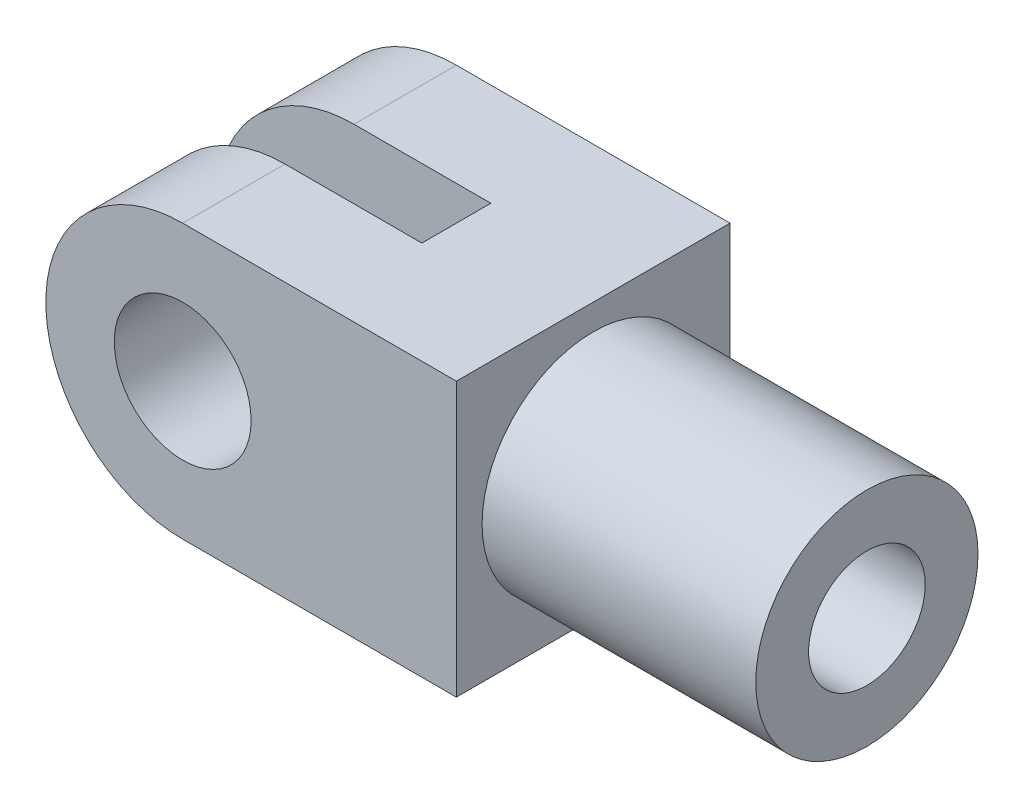
from build123d import *

# Parameters (mm, degrees)
BOSS_EXTRUDE1_DEPTH           = 6.35
SKETCH2_R                     = 2.5781
BOSS_EXTRUDE2_DEPTH           = 6.35
TAP_DRILL_FOR_6_32_TAP1_D     = 2.7051
TAP_DRILL_FOR_6_32_TAP1_DEPTH = 9.525
TAP_DRILL_FOR_6_32_TAP1_TIP   = 0.81269403
CUT_EXTRUDE1_REACH            = 15.091
SKETCH5_W                     = 10.16
SKETCH5_H                     = 1.6002
CUT_EXTRUDE2_REACH            = 15.091
SKETCH6_R                     = 1.5875
F_4_40_TAPPED_HOLE1_D         = 2.2606


with BuildPart() as part:
    # Sketch1 → Boss-Extrude1 (new body)
    with BuildSketch(Plane.XY):
        with BuildLine():
            Line((0, 0), (-6.35, 0))
            ThreePointArc((-6.35, 0), (-9.525, 3.175), (-6.35, 6.35))
            Line((-6.35, 6.35), (0, 6.35))
            Line((0, 6.35), (0, 0))
        make_face()
    extrude(amount=BOSS_EXTRUDE1_DEPTH)

    # Sketch2 → Boss-Extrude2 (add)
    with BuildSketch(Plane(origin=(0, 0, 0), x_dir=(0, 0, -1), z_dir=(1, 0, 0))):
        with Locations((-3.175, 3.175)):
            Circle(SKETCH2_R)
    extrude(amount=BOSS_EXTRUDE2_DEPTH)

    # Tap Drill for #6-32 Tap1
    with Locations(Plane(origin=(6.35, 0, 0), x_dir=(0, 0, -1), z_dir=(1, 0, 0))):
        with Locations((-3.175, 3.175)):
            Hole(TAP_DRILL_FOR_6_32_TAP1_D / 2, depth=TAP_DRILL_FOR_6_32_TAP1_DEPTH)
            with Locations((0, 0, -(TAP_DRILL_FOR_6_32_TAP1_DEPTH + TAP_DRILL_FOR_6_32_TAP1_TIP / 2))):  # 118° drill point
                Cone(0, TAP_DRILL_FOR_6_32_TAP1_D / 2, TAP_DRILL_FOR_6_32_TAP1_TIP, mode=Mode.SUBTRACT)

    # Sketch5 → Cut-Extrude1 (cut, up to next)
    with BuildSketch(Plane.XZ, mode=Mode.PRIVATE) as cut_extrude1_sk1:
        with Locations((-8.255, 3.175)):
            Rectangle(SKETCH5_W, SKETCH5_H)
    cut_extrude1_tool1 = extrude(cut_extrude1_sk1.sketch, amount=-CUT_EXTRUDE1_REACH, mode=Mode.PRIVATE) & part.part
    add(cut_extrude1_tool1.solids().sort_by_distance((-8.255, 0, 3.175))[0], mode=Mode.SUBTRACT)

    # Sketch6 → Cut-Extrude2 (cut, up to next)
    with BuildSketch(Plane.XY.offset(6.35), mode=Mode.PRIVATE) as cut_extrude2_sk1:
        with Locations((-6.35, 3.175)):
            Circle(SKETCH6_R)
    cut_extrude2_tool1 = extrude(cut_extrude2_sk1.sketch, amount=-CUT_EXTRUDE2_REACH, mode=Mode.PRIVATE) & part.part
    add(cut_extrude2_tool1.solids().sort_by_distance((-6.35, 3.175, 6.35))[0], mode=Mode.SUBTRACT)

    # #4-40 Tapped Hole1 (through all)
    with Locations(Plane(origin=(0, 0, 0), x_dir=(-1, 0, 0), z_dir=(0, 0, -1))):
        with Locations((6.35, 3.175)):
            Hole(F_4_40_TAPPED_HOLE1_D / 2)


solid = part.part
